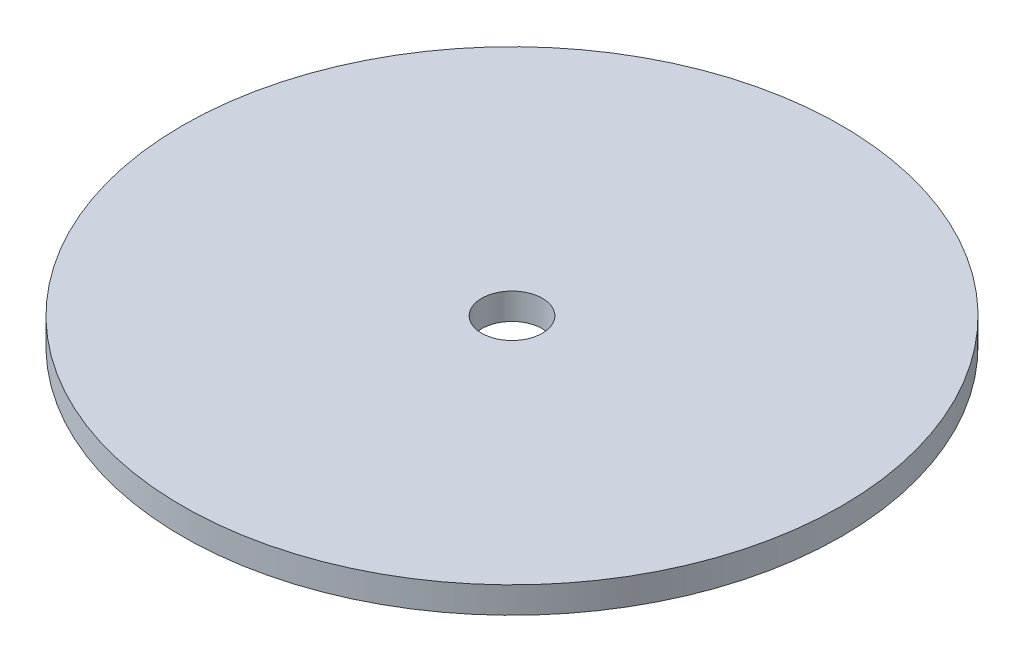
from build123d import *

# Parameters (mm, degrees)
SKETCH1_R           = 37.5
BOSS_EXTRUDE1_DEPTH = 3
CUT_EXTRUDE1_REACH  = 55.118
SKETCH3_R           = 3.45


with BuildPart() as part:
    # Sketch1 → Boss-Extrude1 (new body)
    with BuildSketch(Plane.XZ.offset(0.799365958)):
        Circle(SKETCH1_R)
    extrude(amount=BOSS_EXTRUDE1_DEPTH)

    # Sketch3 → Cut-Extrude1 (cut, up to next)
    with BuildSketch(Plane.XZ.offset(3.799365958), mode=Mode.PRIVATE) as cut_extrude1_sk1:
        Circle(SKETCH3_R)
    cut_extrude1_tool1 = extrude(cut_extrude1_sk1.sketch, amount=-CUT_EXTRUDE1_REACH, mode=Mode.PRIVATE) & part.part
    add(cut_extrude1_tool1.solids().sort_by_distance((0, -3.799366, 0))[0], mode=Mode.SUBTRACT)


solid = part.part
